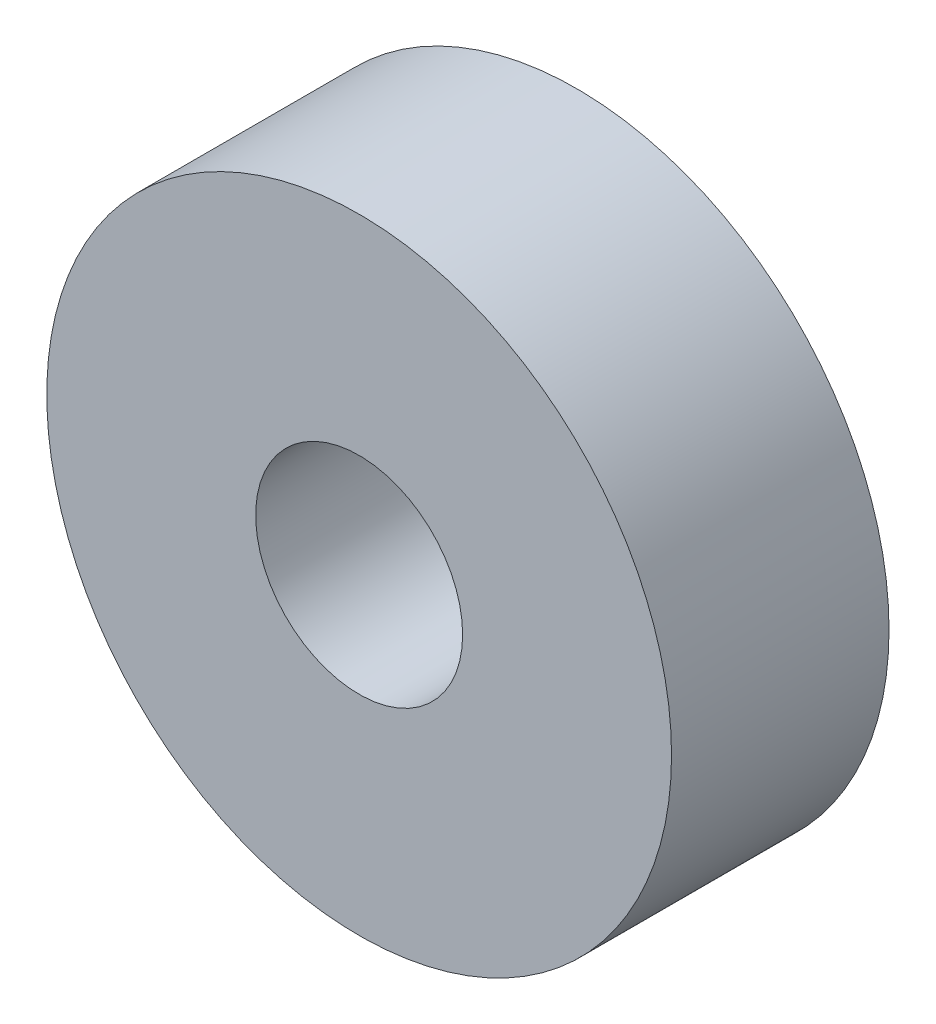
from build123d import *

# Parameters (mm, degrees)
SKETCH1_R      = 14.3002
SKETCH1_R_2    = 4.7371
EXTRUDE1_DEPTH = 9.9568


with BuildPart() as part:
    # Sketch1 → Extrude1 (new body)
    with BuildSketch(Plane.XY):
        Circle(SKETCH1_R)
        Circle(SKETCH1_R_2, mode=Mode.SUBTRACT)
    extrude(amount=EXTRUDE1_DEPTH)


solid = part.part
